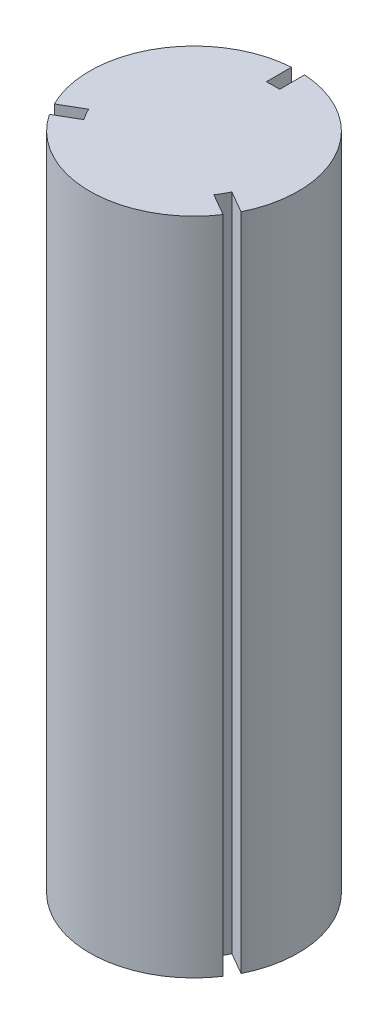
from build123d import *

# Parameters (mm, degrees)
SKETCH1_R           = 3.95
BOSS_EXTRUDE1_DEPTH = 25
CUT_EXTRUDE1_DEPTH  = 25


with BuildPart() as part:
    # Sketch1 → Boss-Extrude1 (new body)
    with BuildSketch(Plane(origin=(0, 0, 0), x_dir=(1, 0, 0), z_dir=(0, 1, 0))):
        with Locations(Location((0, 0, 0), (0, 0, 270))):
            Circle(SKETCH1_R)
    extrude(amount=BOSS_EXTRUDE1_DEPTH)

    # Sketch2 → Cut-Extrude1 (cut)
    with BuildSketch(Plane(origin=(0, 25, 0), x_dir=(1, 0, 0), z_dir=(0, 1, 0))):
        with BuildLine():
            ThreePointArc((-0.25, 2.989565186), (0, 3), (0.25, 2.989565186))
            Line((0.25, 2.989565186), (0.25, 3.942080669))
            Line((0.25, 3.942080669), (-0.25, 3.942080669))
            Line((-0.25, 3.942080669), (-0.25, 2.989565186))
        make_face()
        with BuildLine():
            Line((-3.288942003, -2.187546685), (-2.464039397, -1.711288944))
            ThreePointArc((-2.464039397, -1.711288944), (-2.598076211, -1.5), (-2.714039397, -1.278276242))
            Line((-2.714039397, -1.278276242), (-3.538942003, -1.754533983))
            Line((-3.538942003, -1.754533983), (-3.288942003, -2.187546685))
        make_face()
        with BuildLine():
            Line((3.538942003, -1.754533983), (2.714039397, -1.278276242))
            ThreePointArc((2.714039397, -1.278276242), (2.598076211, -1.5), (2.464039397, -1.711288944))
            Line((2.464039397, -1.711288944), (3.288942003, -2.187546685))
            Line((3.288942003, -2.187546685), (3.538942003, -1.754533983))
        make_face()
    extrude(amount=-CUT_EXTRUDE1_DEPTH, mode=Mode.SUBTRACT)


with BuildPart() as cut_extrude1_kept_piece:
    # of the separate pieces the step leaves, the one the design keeps (cut_extrude1_pieces_kept)
    add(part.part.solids().sort_by_distance((2.464039397, 25, 1.711288944))[0])


solid = cut_extrude1_kept_piece.part
